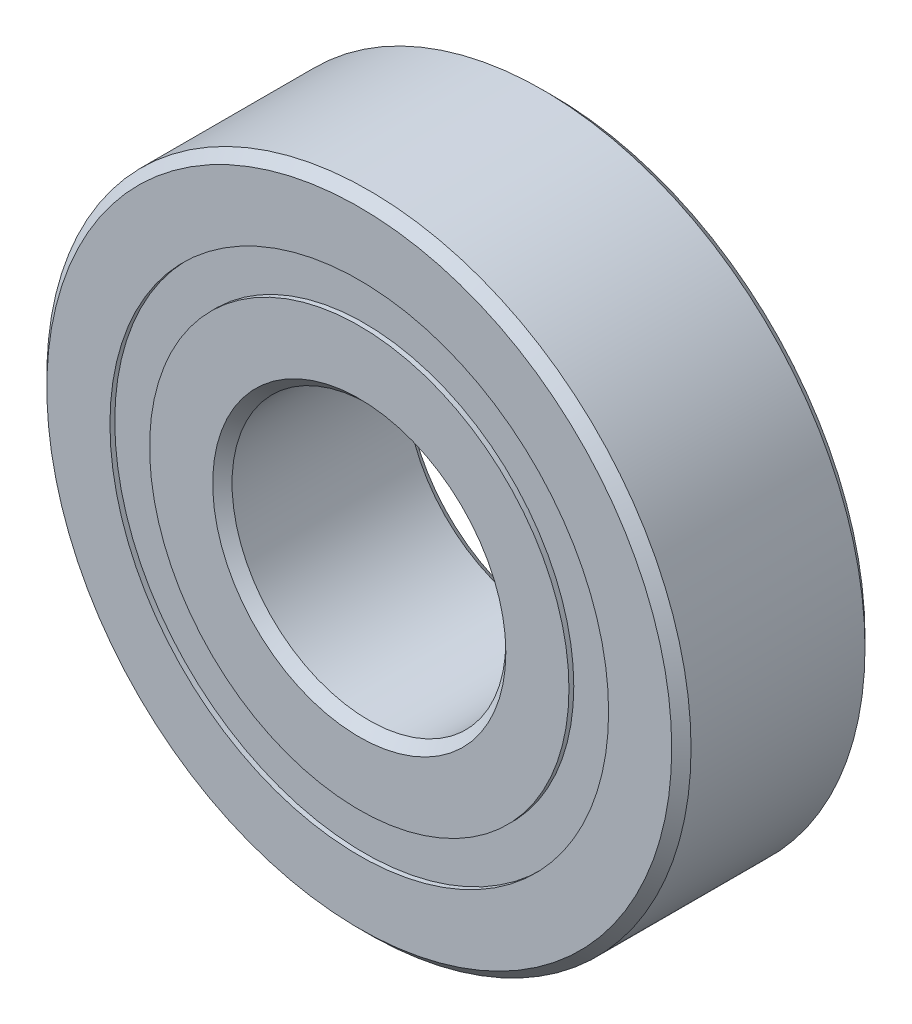
from build123d import *

# Parameters (mm, degrees)
CIRPATTERN1_COUNT = 14
SKETCH6_W         = 2.763011064
SKETCH6_H         = 2.461538462


with BuildPart() as part:
    # Sketch1 → Revolve1 (revolve)
    with BuildSketch(Plane(origin=(0, 0, 0), x_dir=(0, 0, -1), z_dir=(1, 0, 0)), mode=Mode.PRIVATE) as revolve1_sk:
        with BuildLine():
            Line((5.4, 20), (-5.4, 20))
            Line((-5.4, 20), (-6, 19.4))
            Line((-6, 19.4), (-6, 15.480769231))
            Line((-6, 15.480769231), (-2.666666667, 15.480769231))
            ThreePointArc((-2.666666667, 15.480769231), (0, 17.186988936), (2.666666667, 15.480769231))
            Line((2.666666667, 15.480769231), (6, 15.480769231))
            Line((6, 15.480769231), (6, 19.4))
            Line((6, 19.4), (5.4, 20))
        make_face()
    revolve(revolve1_sk.sketch.rotate(Axis((0, 0, 6), (0, 0, -1)), 90), axis=Axis((0, 0, 6), (0, 0, -1)))


with BuildPart() as body_2:
    # Sketch3 → Revolve3 (revolve)
    with BuildSketch(Plane(origin=(0, 0, 0), x_dir=(0, 0, -1), z_dir=(1, 0, 0)), mode=Mode.PRIVATE) as revolve3_sk:
        with BuildLine():
            Line((-6, 13.019230769), (-2.666666667, 13.019230769))
            ThreePointArc((-2.666666667, 13.019230769), (0, 11.313011064), (2.666666667, 13.019230769))
            Line((2.666666667, 13.019230769), (6, 13.019230769))
            Line((6, 13.019230769), (6, 9.1))
            Line((6, 9.1), (5.4, 8.5))
            Line((5.4, 8.5), (-5.4, 8.5))
            Line((-5.4, 8.5), (-6, 9.1))
            Line((-6, 9.1), (-6, 13.019230769))
        make_face()
    revolve(revolve3_sk.sketch.rotate(Axis((0, 0, 6), (0, 0, -1)), 90), axis=Axis((0, 0, 6), (0, 0, -1)))


with BuildPart() as body_3:
    # Sketch4 → Revolve4 (revolve)
    with BuildSketch(Plane(origin=(0, 0, 0), x_dir=(0, 0, -1), z_dir=(1, 0, 0))):
        with BuildLine():
            Line((-2.936988936, 14.25), (2.936988936, 14.25))
            ThreePointArc((2.936988936, 14.25), (0, 17.186988936), (-2.936988936, 14.25))
        make_face()
    revolve(axis=Axis((0, 14.25, 2.936988936), (0, 0, -1)))


with BuildPart() as cirpattern1_1:
    # CirPattern1: pattern copy
    add(body_3.part.rotate(Axis((0, 0, 0), (0, 0, 1)), 1 * 360 / CIRPATTERN1_COUNT))


with BuildPart() as cirpattern1_2:
    # CirPattern1: pattern copy
    add(body_3.part.rotate(Axis((0, 0, 0), (0, 0, 1)), 2 * 360 / CIRPATTERN1_COUNT))


with BuildPart() as cirpattern1_3:
    # CirPattern1: pattern copy
    add(body_3.part.rotate(Axis((0, 0, 0), (0, 0, 1)), 3 * 360 / CIRPATTERN1_COUNT))


with BuildPart() as cirpattern1_4:
    # CirPattern1: pattern copy
    add(body_3.part.rotate(Axis((0, 0, 0), (0, 0, 1)), 4 * 360 / CIRPATTERN1_COUNT))


with BuildPart() as cirpattern1_5:
    # CirPattern1: pattern copy
    add(body_3.part.rotate(Axis((0, 0, 0), (0, 0, 1)), 5 * 360 / CIRPATTERN1_COUNT))


with BuildPart() as cirpattern1_6:
    # CirPattern1: pattern copy
    add(body_3.part.rotate(Axis((0, 0, 0), (0, 0, 1)), 6 * 360 / CIRPATTERN1_COUNT))


with BuildPart() as cirpattern1_7:
    # CirPattern1: pattern copy
    add(body_3.part.rotate(Axis((0, 0, 0), (0, 0, 1)), 7 * 360 / CIRPATTERN1_COUNT))


with BuildPart() as cirpattern1_8:
    # CirPattern1: pattern copy
    add(body_3.part.rotate(Axis((0, 0, 0), (0, 0, 1)), 8 * 360 / CIRPATTERN1_COUNT))


with BuildPart() as cirpattern1_9:
    # CirPattern1: pattern copy
    add(body_3.part.rotate(Axis((0, 0, 0), (0, 0, 1)), 9 * 360 / CIRPATTERN1_COUNT))


with BuildPart() as cirpattern1_10:
    # CirPattern1: pattern copy
    add(body_3.part.rotate(Axis((0, 0, 0), (0, 0, 1)), 10 * 360 / CIRPATTERN1_COUNT))


with BuildPart() as cirpattern1_11:
    # CirPattern1: pattern copy
    add(body_3.part.rotate(Axis((0, 0, 0), (0, 0, 1)), 11 * 360 / CIRPATTERN1_COUNT))


with BuildPart() as cirpattern1_12:
    # CirPattern1: pattern copy
    add(body_3.part.rotate(Axis((0, 0, 0), (0, 0, 1)), 12 * 360 / CIRPATTERN1_COUNT))


with BuildPart() as cirpattern1_13:
    # CirPattern1: pattern copy
    add(body_3.part.rotate(Axis((0, 0, 0), (0, 0, 1)), 13 * 360 / CIRPATTERN1_COUNT))


with BuildPart() as body_17:
    # Sketch6 → Revolve5 (revolve)
    with BuildSketch(Plane(origin=(0, 0, 0), x_dir=(0, 0, -1), z_dir=(1, 0, 0)), mode=Mode.PRIVATE) as revolve5_sk:
        with Locations((-4.318494468, 14.25)):
            Rectangle(SKETCH6_W, SKETCH6_H)
        with Locations((4.318494468, 14.25)):
            Rectangle(SKETCH6_W, SKETCH6_H)
    revolve(revolve5_sk.sketch.rotate(Axis((0, 0, 6), (0, 0, -1)), 90), axis=Axis((0, 0, 6), (0, 0, -1)))


solid = Compound([part.part, body_2.part, body_3.part, cirpattern1_1.part, cirpattern1_2.part, cirpattern1_3.part, cirpattern1_4.part, cirpattern1_5.part, cirpattern1_6.part, cirpattern1_7.part, cirpattern1_8.part, cirpattern1_9.part, cirpattern1_10.part, cirpattern1_11.part, cirpattern1_12.part, cirpattern1_13.part, body_17.part])
